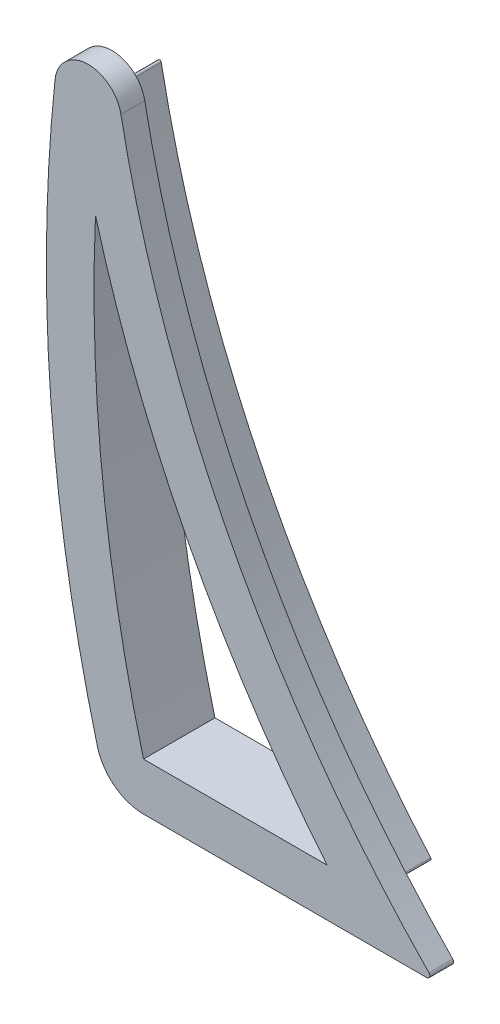
from build123d import *

# Parameters (mm, degrees)
BOSS_EXTRU_1_DEPTH = 3
CONG_1_R           = 0.1
BOSS_EXTRU_2_DEPTH = 1.5
CONG_2_R           = 0.2
CONG_3_R           = 0.1


with BuildPart() as part:
    # Esquisse1 → Boss.-Extru.1 (new body)
    with BuildSketch(Plane.XY):
        with BuildLine():
            ThreePointArc((-5.491443118, -17.402412154), (-5.134783325, -17.939342697), (-4.524586287, -18.147093005))
            Line((-4.524586287, -18.147093005), (9.198940383, -18.147093005))
            ThreePointArc((9.198940383, -18.147093005), (-1.821522293, -1.442775514), (-8.03233352, 17.581173717))
            ThreePointArc((-8.03233352, 17.581173717), (-8.390456717, -0.028903657), (-5.491443118, -17.402412154))
        make_face()
        with BuildLine():
            Line((7.041670832, -17.147093005), (-4.524586287, -17.147093005))
            ThreePointArc((-4.524586287, -17.147093005), (-7.101772019, -3.192262147), (-7.54889357, 10.99150579))
            ThreePointArc((-7.54889357, 10.99150579), (-1.736845674, -3.846887542), (7.041670832, -17.147093005))
        make_face(mode=Mode.SUBTRACT)
    extrude(amount=BOSS_EXTRU_1_DEPTH)

    # Congé1
    cong_1_edges = [part.edges().sort_by_distance(p)[0] for p in [
        (-8.03233352, 17.581173717, 1.5),
    ]]
    fillet(cong_1_edges, radius=CONG_1_R)

    # Esquisse2 → Boss.-Extru.2 (add)
    with BuildSketch(Plane.XY.offset(3)):
        with BuildLine():
            ThreePointArc((-7.425156781, -17.913050452), (-6.355177402, -19.523842081), (-4.524586287, -20.147093005))
            Line((-4.524586287, -20.147093005), (13.781531415, -20.147093005))
            ThreePointArc((13.781531415, -20.147093005), (1.144889736, -2.883958877), (-5.944425785, 17.301236646))
            ThreePointArc((-5.944425785, 17.301236646), (-8.095151796, 19.001327524), (-10.094549972, 17.125604115))
            ThreePointArc((-10.094549972, 17.125604115), (-10.359767763, -0.515611426), (-7.425156781, -17.913050452))
        make_face()
        with BuildLine():
            ThreePointArc((-7.54889357, 10.99150579), (-1.736845674, -3.846887542), (7.041670832, -17.147093005))
            Line((7.041670832, -17.147093005), (-4.524586287, -17.147093005))
            ThreePointArc((-4.524586287, -17.147093005), (-7.101772019, -3.192262147), (-7.54889357, 10.99150579))
        make_face(mode=Mode.SUBTRACT)
    extrude(amount=BOSS_EXTRU_2_DEPTH)

    # Congé2
    cong_2_edges = [part.edges().sort_by_distance(p)[0] for p in [
        (13.781531415, -20.147093005, 3.75),
    ]]
    fillet(cong_2_edges, radius=CONG_2_R)

    # Congé3
    cong_3_edges = [part.edges().sort_by_distance(p)[0] for p in [
        (9.198940383, -18.147093005, 1.5),
    ]]
    fillet(cong_3_edges, radius=CONG_3_R)


solid = part.part
